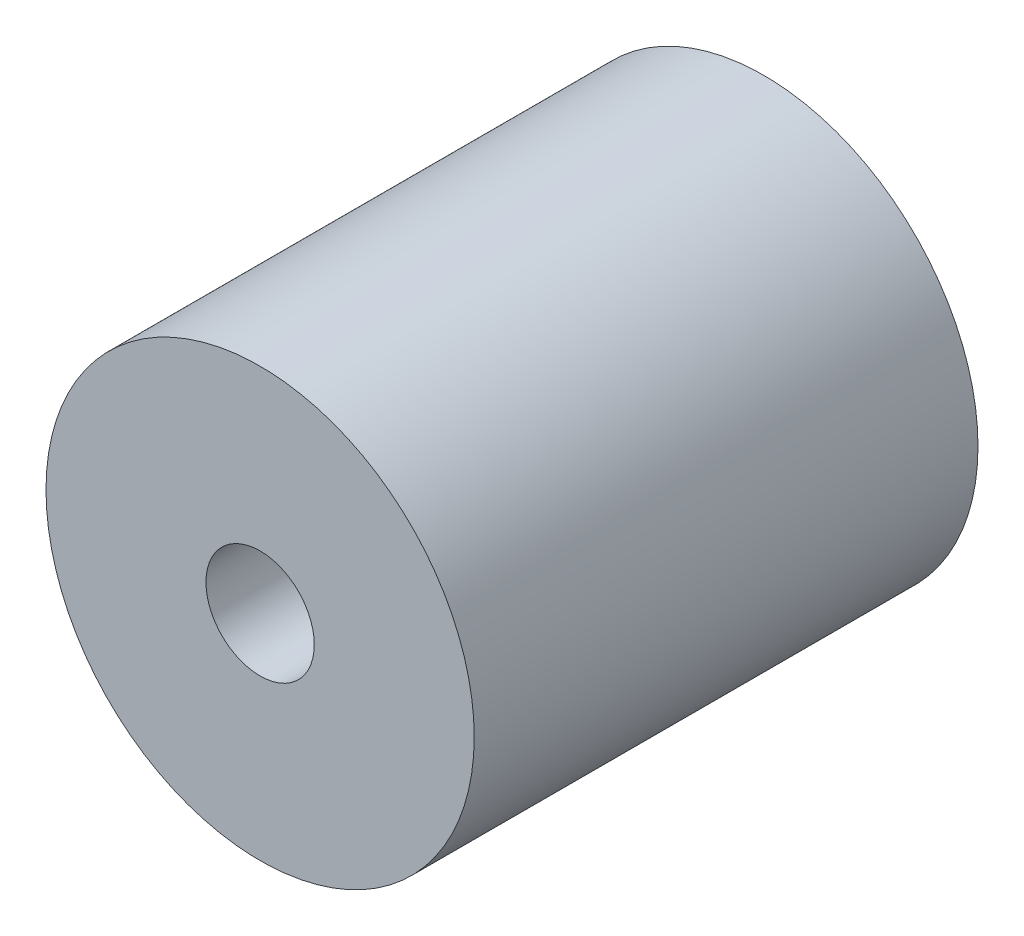
from build123d import *

# Parameters (mm, degrees)
SZKIC1_R                    = 4.25
DODANIE_WYCI_GNI_CIE1_DEPTH = 10
WYTNIJ_WYCI_GNI_CIE1_REACH  = 13.667
SZKIC3_R                    = 1.075


with BuildPart() as part:
    # Szkic1 → Dodanie-wyciągnięcie1 (new body)
    with BuildSketch(Plane.XY):
        Circle(SZKIC1_R)
    extrude(amount=DODANIE_WYCI_GNI_CIE1_DEPTH)

    # Szkic3 → Wytnij-wyciągnięcie1 (cut, up to next)
    with BuildSketch(Plane(origin=(0, 0, 0), x_dir=(-1, 0, 0), z_dir=(0, 0, -1)), mode=Mode.PRIVATE) as wytnij_wyci_gni_cie1_sk1:
        Circle(SZKIC3_R)
    wytnij_wyci_gni_cie1_tool1 = extrude(wytnij_wyci_gni_cie1_sk1.sketch, amount=-WYTNIJ_WYCI_GNI_CIE1_REACH, mode=Mode.PRIVATE) & part.part
    add(wytnij_wyci_gni_cie1_tool1.solids().sort_by_distance((0, 0, 0))[0], mode=Mode.SUBTRACT)


solid = part.part
